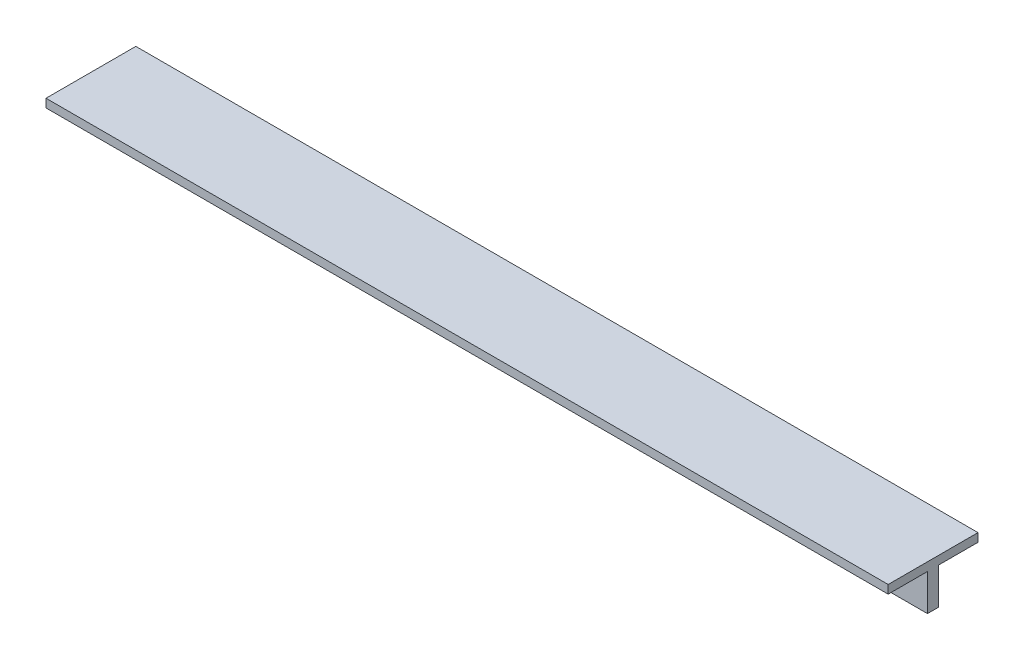
from build123d import *

# Parameters (mm, degrees)
BOSS_EXTRUDE1_DEPTH = 75


with BuildPart() as part:
    # Sketch1 → Boss-Extrude1 (new, symmetric)
    with BuildSketch(Plane(origin=(0, 0, 0), x_dir=(0, 0, -1), z_dir=(1, 0, 0))):
        Polygon((0, 0), (0, -8), (1, -8), (1, -1.5), (8, -1.5), (8, 0), align=None)
    extrude(amount=BOSS_EXTRUDE1_DEPTH, both=True)

    # Mirror2: part across plane


with BuildPart() as part_1:
    add(part.part)
    add(part.part.mirror(Plane(origin=(75, 0, 0), x_dir=(1, 0, 0), z_dir=(0, 0, -1))))


solid = part_1.part
